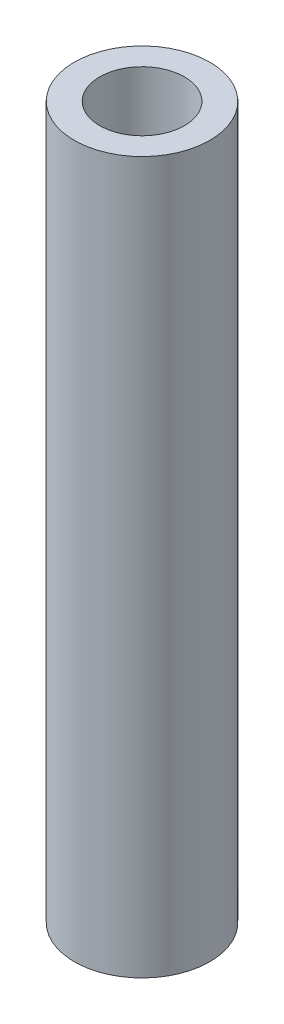
from build123d import *

# Parameters (mm, degrees)
SKETCH_2_R      = 2
SKETCH_2_R_2    = 1.25
EXTRUDE_1_DEPTH = 21


with BuildPart() as part:
    # 草图2 → 凸台-拉伸1 (new body)
    with BuildSketch(Plane(origin=(0, 0, 0), x_dir=(1, 0, 0), z_dir=(0, 1, 0))):
        with Locations(Location((0, 0, 0), (0, 0, 90))):
            Circle(SKETCH_2_R)
        with Locations(Location((0, 0, 0), (0, 0, 90))):
            Circle(SKETCH_2_R_2, mode=Mode.SUBTRACT)
    extrude(amount=EXTRUDE_1_DEPTH)


solid = part.part
